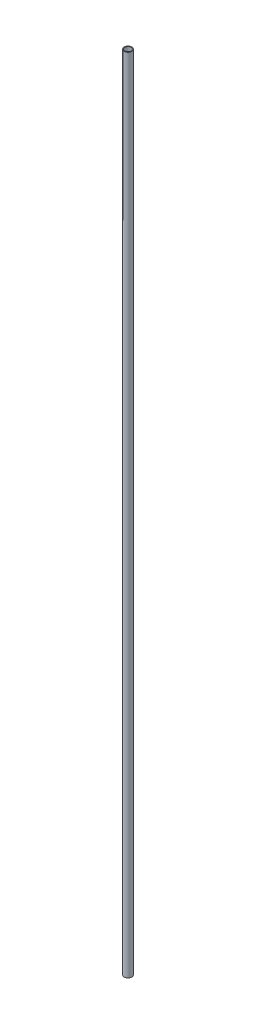
from build123d import *

# Parameters (mm, degrees)
SKETCH1_R           = 6.35
SKETCH1_R_2         = 5.1054
BOSS_EXTRUDE1_DEPTH = 1320.8


with BuildPart() as part:
    # Sketch1 → Boss-Extrude1 (new body)
    with BuildSketch(Plane(origin=(0, 0, 0), x_dir=(1, 0, 0), z_dir=(0, 1, 0))):
        with Locations(Location((0, 0, 0), (0, 0, 270))):
            Circle(SKETCH1_R)
        with Locations(Location((0, 0, 0), (0, 0, 270))):
            Circle(SKETCH1_R_2, mode=Mode.SUBTRACT)
    extrude(amount=BOSS_EXTRUDE1_DEPTH)


solid = part.part
